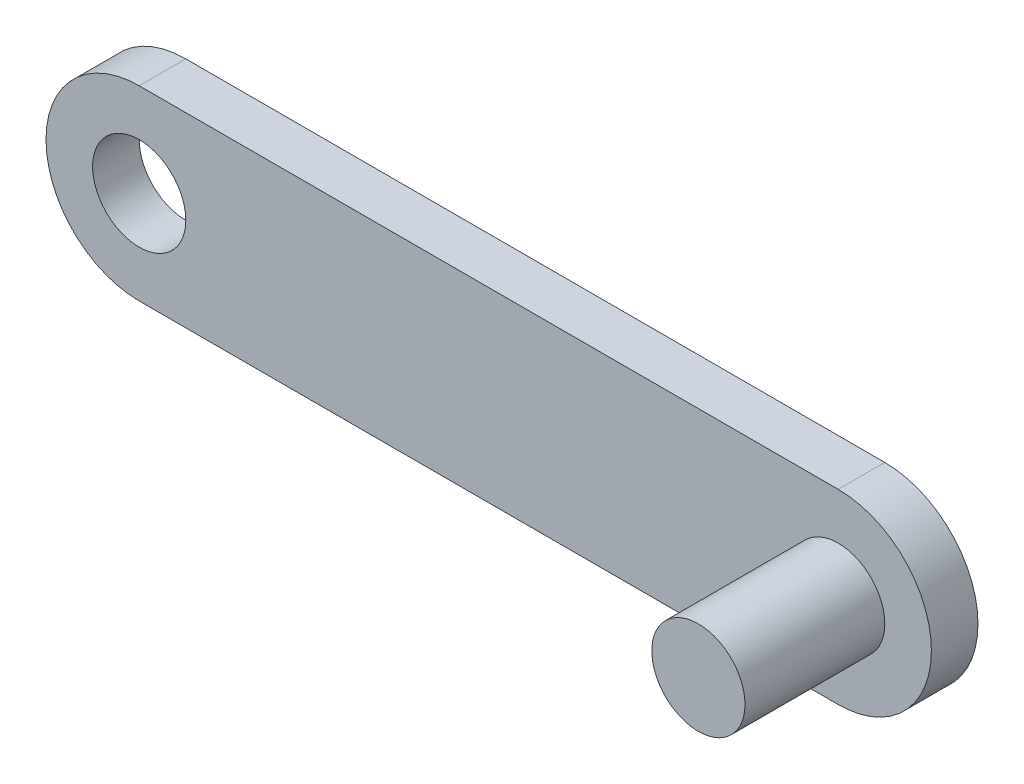
from build123d import *

# Parameters (mm, degrees)
SKETCH_1_R      = 1
EXTRUDE_1_DEPTH = 1
SKETCH_2_R      = 1
EXTRUDE_2_DEPTH = 3


with BuildPart() as part:
    # 草图1 → 凸台-拉伸1 (new body)
    with BuildSketch(Plane.XY):
        with BuildLine():
            Line((0, 2), (15, 2))
            ThreePointArc((15, 2), (17, 0), (15, -2))
            Line((15, -2), (0, -2))
            ThreePointArc((0, -2), (-2, 0), (0, 2))
        make_face()
        Circle(SKETCH_1_R, mode=Mode.SUBTRACT)
    extrude(amount=EXTRUDE_1_DEPTH)

    # 草图2 → 凸台-拉伸2 (add)
    with BuildSketch(Plane.XY.offset(1)):
        with Locations((15, 0)):
            Circle(SKETCH_2_R)
    extrude(amount=EXTRUDE_2_DEPTH)


solid = part.part
